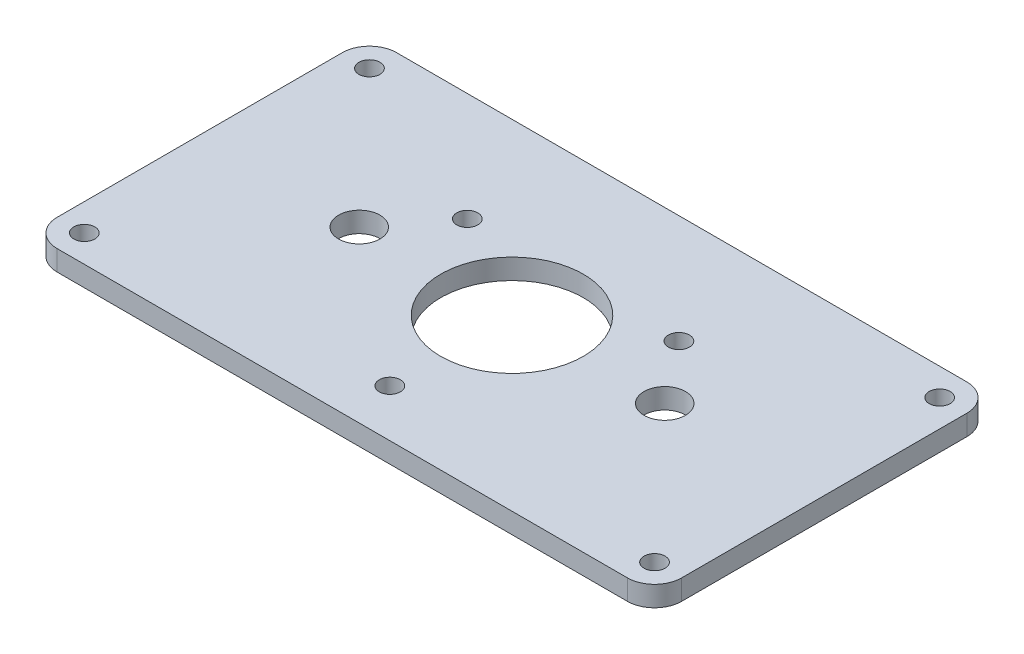
from build123d import *

# Parameters (mm, degrees)
SKETCH1_W           = 92
SKETCH1_H           = 50
SKETCH1_R           = 10.5
SKETCH1_R_2         = 1.55
BOSS_EXTRUDE1_DEPTH = 3
FILLET1_R           = 4
SKETCH_1_R          = 3.05
CUT_EXTRUDE_1_DEPTH = 10


with BuildPart() as part:
    # Sketch1 → Boss-Extrude1 (new body)
    with BuildSketch(Plane(origin=(0, 0, 0), x_dir=(1, 0, 0), z_dir=(0, 1, 0))):
        Rectangle(SKETCH1_W, SKETCH1_H)
        with Locations(Location((0, 0, 0), (0, 0, 270))):
            Circle(SKETCH1_R, mode=Mode.SUBTRACT)
        with Locations(Location((42, 21, 0), (0, 0, 270))):
            Circle(SKETCH1_R_2, mode=Mode.SUBTRACT)
        with Locations(Location((-42, 21, 0), (0, 0, 90))):
            Circle(SKETCH1_R_2, mode=Mode.SUBTRACT)
        with Locations(Location((42, -21, 0), (0, 0, 90))):
            Circle(SKETCH1_R_2, mode=Mode.SUBTRACT)
        with Locations(Location((-42, -21, 0), (0, 0, 270))):
            Circle(SKETCH1_R_2, mode=Mode.SUBTRACT)
        with Locations(Location((0, -18, 0), (0, 0, 270))):
            Circle(SKETCH1_R_2, mode=Mode.SUBTRACT)
        with Locations(Location((-15.588457268, 9, 0), (0, 0, 270))):
            Circle(SKETCH1_R_2, mode=Mode.SUBTRACT)
        with Locations(Location((15.588457268, 9, 0), (0, 0, 270))):
            Circle(SKETCH1_R_2, mode=Mode.SUBTRACT)
    extrude(amount=BOSS_EXTRUDE1_DEPTH)

    # Fillet1
    fillet1_edges = [part.edges().sort_by_distance(p)[0] for p in [
        (46, 1.5, 25),
        (-46, 1.5, 25),
        (-46, 1.5, -25),
        (46, 1.5, -25),
    ]]
    fillet(fillet1_edges, radius=FILLET1_R)

    # 草图1 → 切除-拉伸1 (cut)
    with BuildSketch(Plane.XZ):
        with Locations(Location((-22.5, 0, 0), (0, 0, 270))):
            Circle(SKETCH_1_R)
        with Locations(Location((22.5, 0, 0), (0, 0, 270))):
            Circle(SKETCH_1_R)
    extrude(amount=-CUT_EXTRUDE_1_DEPTH, mode=Mode.SUBTRACT)


solid = part.part
